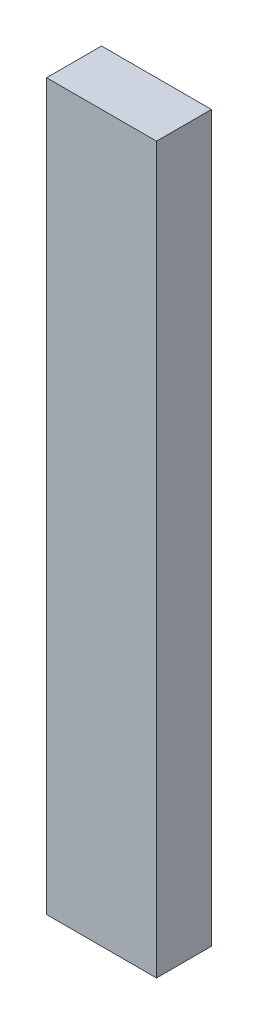
from build123d import *

# Parameters (mm, degrees)
SKETCH1_W           = 101.6
SKETCH1_H           = 50.8
BOSS_EXTRUDE1_DEPTH = 670


with BuildPart() as part:
    # Sketch1 → Boss-Extrude1 (new body)
    with BuildSketch(Plane(origin=(0, 0, 0), x_dir=(1, 0, 0), z_dir=(0, 1, 0))):
        Rectangle(SKETCH1_W, SKETCH1_H)
    extrude(amount=BOSS_EXTRUDE1_DEPTH)


solid = part.part
